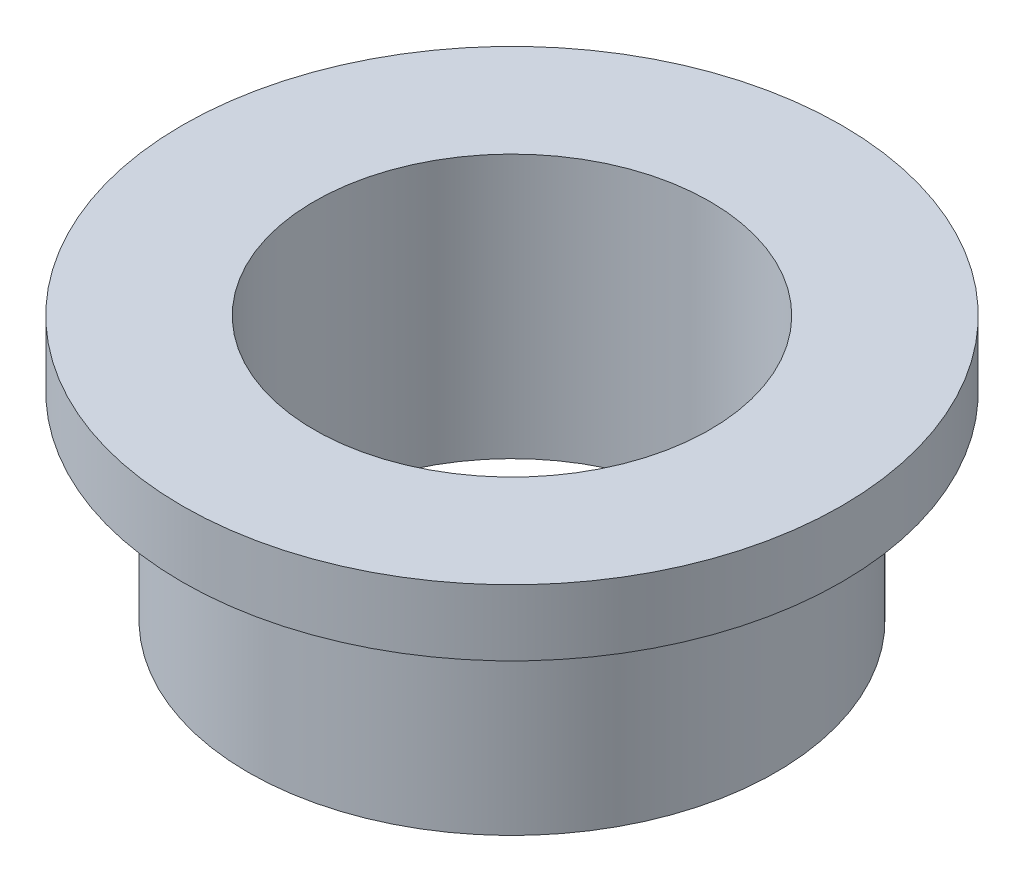
from build123d import *


with BuildPart() as part:
    # 草图1 → 旋转1 (revolve)
    with BuildSketch(Plane(origin=(0, 0, 0), x_dir=(0, 0, -1), z_dir=(1, 0, 0))):
        Polygon((3, 4), (3, 0), (4, 0), (4, 3), (5, 3), (5, 4), align=None)
    revolve(axis=Axis((0, 0, 0), (0, 1, 0)))


solid = part.part
